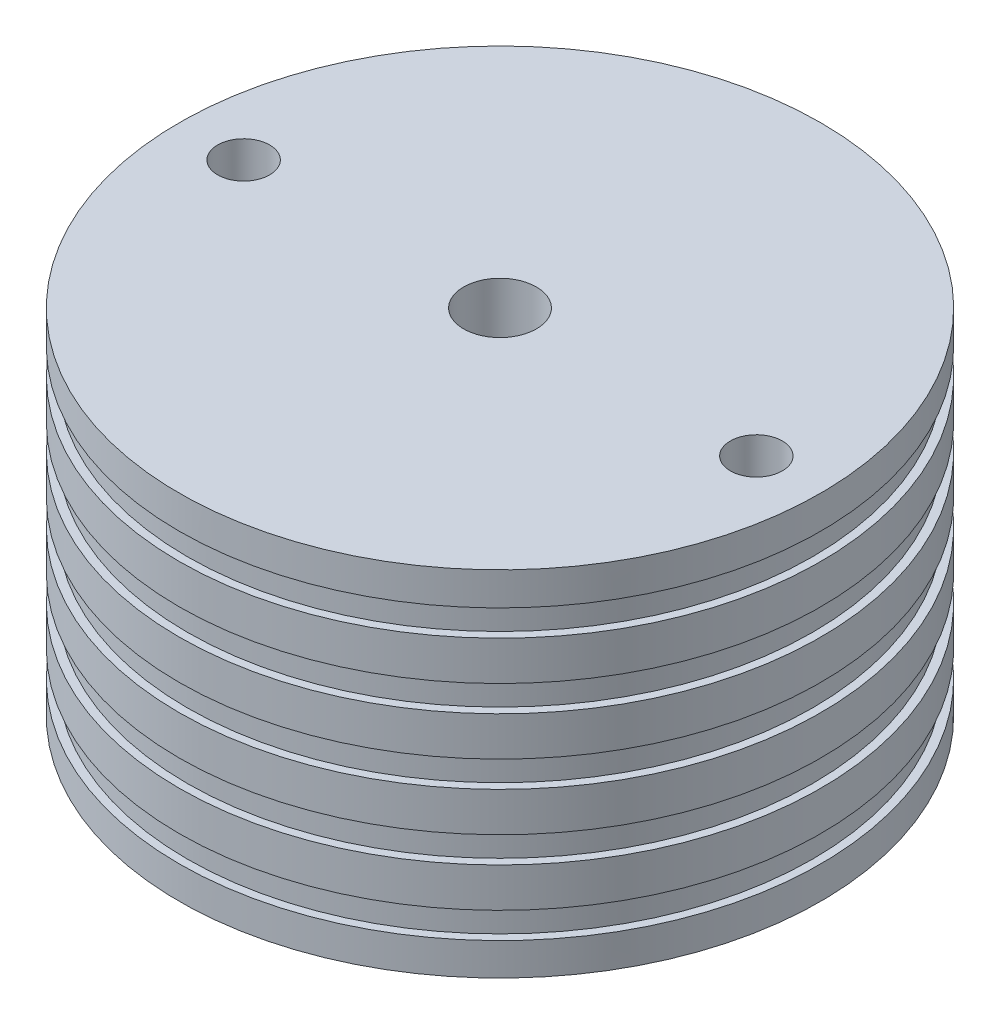
from build123d import *

# Parameters (mm, degrees)
SKETCH2_W               = 1.25
SKETCH2_H               = 4
SKETCH3_W               = 39.44375
SKETCH3_H               = 4
EXTRUDE_THIN1_DEPTH     = 48
SKETCH5_R               = 6.76875
SKETCH5_R_2             = 3.96875
BOSS_EXTRUDE1_DEPTH     = 30
CUT_EXTRUDE1_DEPTH      = 86.451740766
CUT_EXTRUDE1_DEPTH_BACK = 86.451740766
SKETCH5_3_R             = 3.96875
FILLET1_R               = 5


with BuildPart() as part:
    # Sketch1 → Revolve1 (revolve)
    with BuildSketch(Plane.XY):
        Polygon((-5.55625, 0), (-49, 0), (-49, -54), (-45, -54), (-45, -4), (-10.55625, -4), (-10.55625, -20), (-5.55625, -20), align=None)
    revolve(axis=Axis((0, -56.24184261, 0), (0, 1, 0)))

    # Sketch2 → Cut-Revolve1 (revolve, cut)
    with BuildSketch(Plane.XY):
        with Locations((-48.375, -17.040792646)):
            Rectangle(SKETCH2_W, SKETCH2_H)
        with Locations((-48.375, -7.040792646)):
            Rectangle(SKETCH2_W, SKETCH2_H)
        with Locations((-48.375, -27.040792646)):
            Rectangle(SKETCH2_W, SKETCH2_H)
        with Locations((-48.375, -37.040792646)):
            Rectangle(SKETCH2_W, SKETCH2_H)
        with Locations((-48.375, -47.040792646)):
            Rectangle(SKETCH2_W, SKETCH2_H)
    revolve(axis=Axis((0, 0, 0), (0, -1, 0)), mode=Mode.SUBTRACT)

    # Sketch3 → Extrude-Thin1 (add)
    with BuildSketch(Plane.XZ.offset(4)):
        with Locations((-25.278125, 0)):
            Rectangle(SKETCH3_W, SKETCH3_H)
        Polygon((-1.046074192, 5.81185365), (-20.767949192, 39.97114317), (-24.232050808, 37.97114317), (-4.510175808, 3.81185365), align=None)
        Polygon((4.510175808, 3.81185365), (24.232050808, 37.97114317), (20.767949192, 39.97114317), (1.046074192, 5.81185365), align=None)
        with Locations((25.278125, 0)):
            Rectangle(SKETCH3_W, SKETCH3_H)
        Polygon((1.046074192, -5.81185365), (20.767949192, -39.97114317), (24.232050808, -37.97114317), (4.510175808, -3.81185365), align=None)
        Polygon((-4.510175808, -3.81185365), (-24.232050808, -37.97114317), (-20.767949192, -39.97114317), (-1.046074192, -5.81185365), align=None)
    extrude(amount=EXTRUDE_THIN1_DEPTH)

    # Sketch4 → Cut-Revolve3 (revolve, cut)
    with BuildSketch(Plane.XY):
        with BuildLine():
            Line((-5.484281518, -20), (-10.55625, -20))
            ThreePointArc((-10.55625, -20), (-15.774409254, -14.554342155), (-23.149924297, -16.13109617))
            ThreePointArc((-23.149924297, -16.13109617), (-37.600626241, -32.276688518), (-43.928919859, -53))
            Line((-43.928919859, -53), (-5.55625, -53))
            Line((-5.55625, -53), (-5.484281518, -20))
        make_face()
    revolve(axis=Axis((0, 0, 0), (0, -1, 0)), mode=Mode.SUBTRACT)

    # Sketch5 → Boss-Extrude1 (add)
    # profile 1 of 2: a face of its own
    with BuildSketch(Plane.XZ.offset(4)):
        with Locations((-39.154, 0)):
            Circle(SKETCH5_R)
        with Locations((-39.154, 0)):
            Circle(SKETCH5_R_2, mode=Mode.SUBTRACT)
    # profile 2 of 2: a face of its own
    with BuildSketch(Plane.XZ.offset(4)):
        with Locations((39.154, 0)):
            Circle(SKETCH5_R)
        with Locations((39.154, 0)):
            Circle(SKETCH5_R_2, mode=Mode.SUBTRACT)
    extrude(amount=BOSS_EXTRUDE1_DEPTH)

    # Sketch5<3> → Cut-Extrude1 (cut, two sides: drawn at the far end of the back side and taken through both)
    with BuildSketch(Plane.XZ.offset(4).offset(-CUT_EXTRUDE1_DEPTH_BACK)):
        with Locations((-39.154, 0)):
            Circle(SKETCH5_3_R)
        with Locations((39.154, 0)):
            Circle(SKETCH5_3_R)
    extrude(amount=CUT_EXTRUDE1_DEPTH + CUT_EXTRUDE1_DEPTH_BACK, mode=Mode.SUBTRACT)

    # Fillet1
    fillet1_edges = [part.edges().sort_by_distance(p)[0] for p in [
        (-38.550059852, -4, -23.214066541),
        (-38.241674484, -4, -6.706984324),
        (38.550059852, -4, -23.214066541),
        (38.241674484, -4, -6.706984324),
        (38.550059852, -4, 23.214066541),
        (38.241674484, -4, 6.706984324),
        (-38.241674484, -4, 6.706984324),
        (-38.550059852, -4, 23.214066541),
        (-21.526264982, -4, -2),
        (-9.141980669, -4, -5.278125),
        (-15.562198544, -4, -22.954518556),
        (15.562198544, -4, -22.954518556),
        (9.141980669, -4, -5.278125),
        (21.526264982, -4, -2),
        (21.526264982, -4, 2),
        (9.141980669, -4, 5.278125),
        (15.562198544, -4, 22.954518556),
        (-15.562198544, -4, 22.954518556),
        (-9.141980669, -4, 5.278125),
        (-21.526264982, -4, 2),
        (12.098096929, -4, -24.954518556),
        (0, -4, -45),
        (-12.098096929, -4, -24.954518556),
        (0, -4, -10.55625),
        (-12.098096929, -4, 24.954518556),
        (0, -4, 45),
        (12.098096929, -4, 24.954518556),
        (0, -4, 10.55625),
    ]]
    fillet(fillet1_edges, radius=FILLET1_R)


solid = part.part
